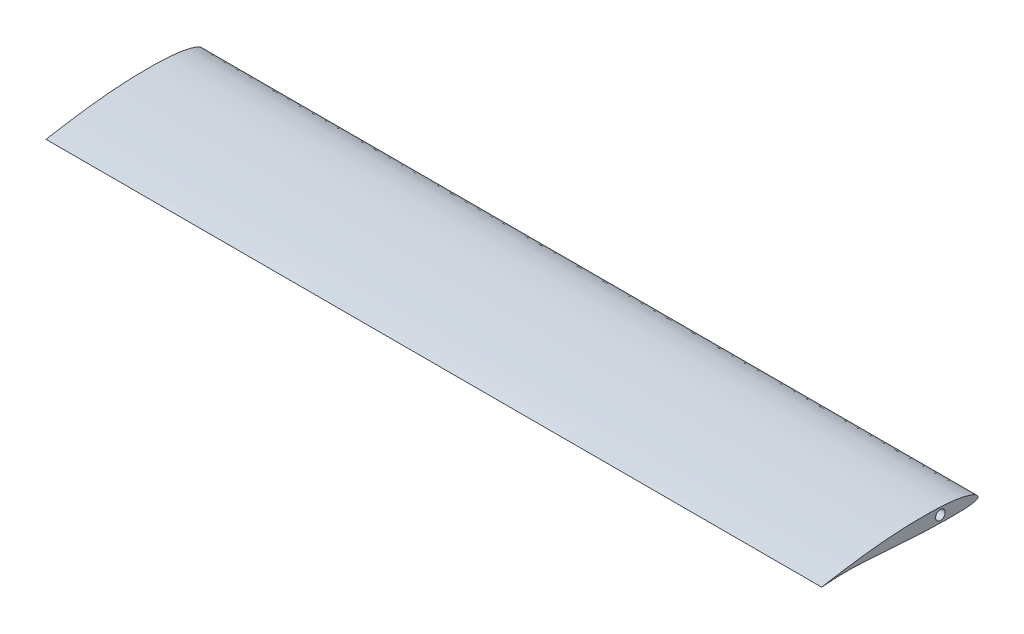
from build123d import *

# Parameters (mm, degrees)
ESTRUSIONE_ESTRUSIONE1_DEPTH = 1290
SCHIZZO2_R                   = 8
TAGLIO_ESTRUSIONE1_DEPTH     = 1317.057155152


with BuildPart() as part:
    # Schizzo1 → Estrusione-Estrusione1 (new body)
    with BuildSketch(Plane(origin=(0, 0, 0), x_dir=(0, 0, -1), z_dir=(1, 0, 0))):
        with BuildLine():
            add(Edge.make_bspline(
                [(-260, 0), (-260.000237425, -0.008364508), (-258.216353736, 0.179270684), (-256.378836916, 0.321037615), (-251.876962837, 0.713121338), (-246.278719714, 1.11706559), (-238.86760139, 1.55720993), (-230.031525046, 1.896147347), (-219.791122936, 2.046331145), (-208.386036068, 1.906549899), (-196.039910167, 1.445189501), (-182.991834914, 0.734254641), (-169.448681914, -0.166616987), (-155.600402613, -1.19393698), (-141.623409195, -2.278561906), (-127.67782617, -3.348367338), (-113.900855731, -4.318852852), (-100.407939814, -5.136106939), (-87.298452074, -5.758303931), (-74.673912862, -6.185554133), (-62.655066243, -6.467188976), (-51.374682206, -6.609584546), (-40.973115242, -6.636643481), (-31.576412236, -6.5156512), (-23.308668347, -6.252651514), (-16.25127632, -5.821331257), (-10.474783811, -5.125854843), (-5.925600317, -4.202064861), (-2.730333464, -2.980383104), (-0.514679594, -1.779989609), (0.022165051, -0.4268724), (-0.032415968, 0.82436622), (-0.845103212, 2.39791171), (-2.838018057, 4.407886521), (-6.000703531, 6.362899006), (-10.276180516, 8.23013797), (-15.677927686, 10.026970906), (-22.15070231, 11.735252347), (-29.637059005, 13.299917029), (-38.071668342, 14.661748304), (-47.395949578, 15.765806178), (-57.546226477, 16.599340158), (-68.449197958, 17.153832528), (-80.008631311, 17.463669293), (-92.109626989, 17.539344296), (-104.620879881, 17.395783903), (-117.404379022, 17.038720466), (-130.324080452, 16.458596613), (-143.253542741, 15.654425145), (-156.075279757, 14.621712637), (-168.679030058, 13.396850465), (-180.948637295, 12.01125156), (-192.766459024, 10.520899718), (-204.009604966, 8.97767429), (-214.552459058, 7.416774439), (-224.18276461, 5.960470639), (-232.936243324, 4.465026932), (-240.61794987, 3.309081229), (-247.256298541, 2.182900114), (-252.32695214, 1.295696393), (-256.510310506, 0.574979544), (-258.261534378, 0.256065435), (-259.999764506, 0.008296472), (-260, 0)],
                knots=[0, 0, 0, 0, 0.001588889, 0.006329218, 0.014202456, 0.025172808, 0.039173483, 0.056060631, 0.075578924, 0.097363607, 0.120926258, 0.145825281, 0.171670912, 0.198108537, 0.224790184, 0.25139058, 0.277643491, 0.30332675, 0.328257458, 0.352272548, 0.375156062, 0.396620664, 0.416422729, 0.43430442, 0.45005468, 0.463465465, 0.474478994, 0.483169222, 0.489678354, 0.494104066, 0.496910015, 0.497289785, 0.501214273, 0.50645795, 0.513356957, 0.522168632, 0.53296597, 0.545689209, 0.560220779, 0.576438923, 0.594258689, 0.613600245, 0.634342386, 0.656331109, 0.679351894, 0.703152303, 0.727478208, 0.752070739, 0.776691164, 0.801140184, 0.825214387, 0.848697424, 0.871352858, 0.892947449, 0.913230871, 0.931955467, 0.948342069, 0.963693004, 0.976235918, 0.986320059, 0.993788799, 0.998424035, 1, 1, 1, 1], degree=3))
        make_face()
    extrude(amount=ESTRUSIONE_ESTRUSIONE1_DEPTH)

    # Schizzo2 → Taglio-Estrusione1 (cut, through all)
    with BuildSketch(Plane(origin=(1290, 0, 0), x_dir=(0, 0, -1), z_dir=(1, 0, 0))):
        with Locations((-62.5, 5.194654773)):
            Circle(SCHIZZO2_R)
    extrude(amount=-TAGLIO_ESTRUSIONE1_DEPTH, mode=Mode.SUBTRACT)


solid = part.part
